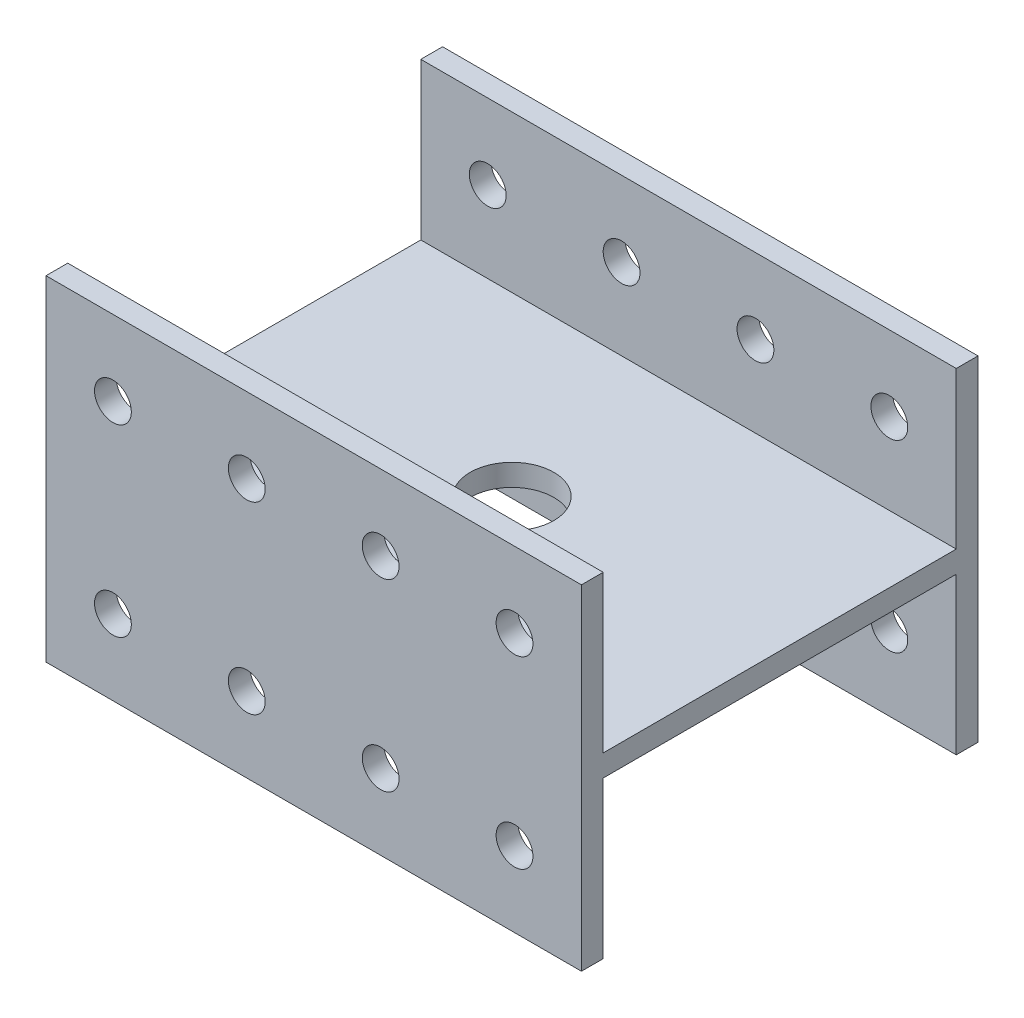
from build123d import *

# Parameters (mm, degrees)
SKETCH_1_W                  = 320
SKETCH_1_H                  = 200
EXTRUDE_1_DEPTH             = 237
SKETCH_2_R                  = 11
CUT_EXTRUDE_1_DEPTH         = 446.610816745
PATTERN_LINEAR_1_COUNT      = 4
PATTERN_LINEAR_1_PITCH      = 80
PATTERN_LINEAR_1_COUNT_DIR2 = 2
PATTERN_LINEAR_1_PITCH_DIR2 = 110
SKETCH_6_W                  = 211
SKETCH_6_H                  = 93.5
CUT_EXTRUDE_3_DEPTH         = 446.610816745
SKETCH_7_R                  = 25
CUT_EXTRUDE_4_DEPTH         = 413.202923328


with BuildPart() as part:
    # 草图1 → 拉伸1 (new body)
    with BuildSketch(Plane.XY):
        with Locations((160, 100)):
            Rectangle(SKETCH_1_W, SKETCH_1_H)
    extrude(amount=EXTRUDE_1_DEPTH)

    # 草图2 → 切除-拉伸1 (cut, through all)
    with BuildSketch(Plane.XY.offset(237)):
        with Locations((40, 45)):
            Circle(SKETCH_2_R)
    cut_extrude_1 = extrude(amount=-CUT_EXTRUDE_1_DEPTH, mode=Mode.SUBTRACT)

    # 阵列(线性)1: Cut-Extrude 1 4 × 2
    with Locations(*[(i * PATTERN_LINEAR_1_PITCH, j * PATTERN_LINEAR_1_PITCH_DIR2, 0) for i in range(PATTERN_LINEAR_1_COUNT) for j in range(PATTERN_LINEAR_1_COUNT_DIR2) if (i, j) != (0, 0)]):
        add(cut_extrude_1, mode=Mode.SUBTRACT)

    # 草图6 → 切除-拉伸3 (cut, through all)
    with BuildSketch(Plane.ZY):
        with Locations((118.5, 153.25)):
            Rectangle(SKETCH_6_W, SKETCH_6_H)
        with Locations((118.5, 46.75)):
            Rectangle(SKETCH_6_W, SKETCH_6_H)
    extrude(amount=-CUT_EXTRUDE_3_DEPTH, mode=Mode.SUBTRACT)

    # 草图7 → 切除-拉伸4 (cut, through all)
    with BuildSketch(Plane(origin=(0, 106.5, 0), x_dir=(1, 0, 0), z_dir=(0, 1, 0))):
        with Locations(Location((160, -118.5, 0), (0, 0, 270))):
            Circle(SKETCH_7_R)
    extrude(amount=-CUT_EXTRUDE_4_DEPTH, mode=Mode.SUBTRACT)


solid = part.part
